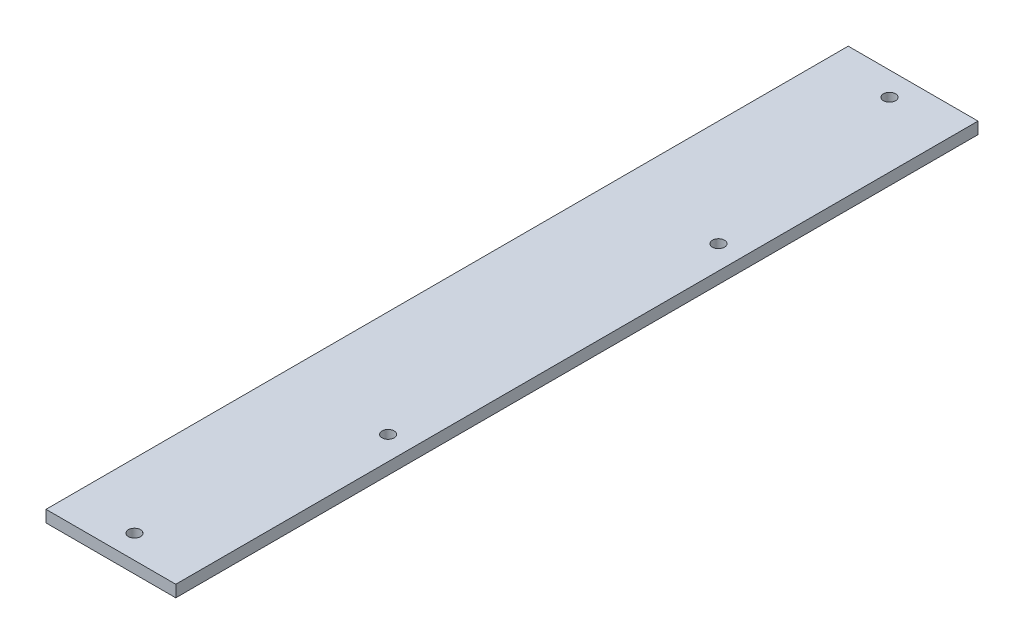
from build123d import *

# Parameters (mm, degrees)
SKETCH1_W           = 69.85
SKETCH1_H           = 431.8
BOSS_EXTRUDE1_DEPTH = 6.35
SKETCH2_R           = 3.2639
CUT_EXTRUDE1_DEPTH  = 438.459238101


with BuildPart() as part:
    # Sketch1 → Boss-Extrude1 (new body)
    with BuildSketch(Plane(origin=(0, 0, 0), x_dir=(1, 0, 0), z_dir=(0, 1, 0))):
        with Locations((34.925, 215.9)):
            Rectangle(SKETCH1_W, SKETCH1_H)
    extrude(amount=BOSS_EXTRUDE1_DEPTH)

    # Sketch2 → Cut-Extrude1 (cut, through all)
    with BuildSketch(Plane(origin=(0, 6.35, 0), x_dir=(1, 0, 0), z_dir=(0, 1, 0))):
        with Locations(Location((34.925, 419.1, 0), (0, 0, 270))):
            Circle(SKETCH2_R)
        with Locations(Location((57.15, 304.8, 0), (0, 0, 270))):
            Circle(SKETCH2_R)
        with Locations(Location((57.15, 127, 0), (0, 0, 90))):
            Circle(SKETCH2_R)
        with Locations(Location((34.925, 12.7, 0), (0, 0, 90))):
            Circle(SKETCH2_R)
    extrude(amount=-CUT_EXTRUDE1_DEPTH, mode=Mode.SUBTRACT)


solid = part.part
